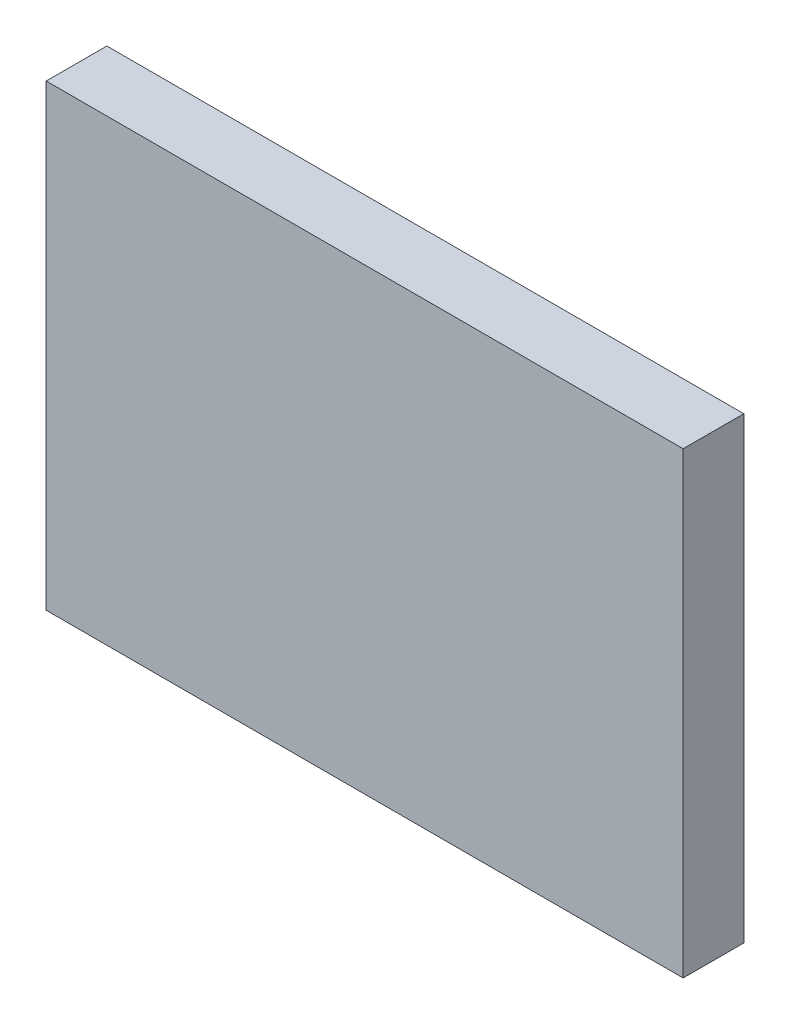
from build123d import *

# Parameters (mm, degrees)
SKETCH1_W           = 66.7
SKETCH1_H           = 48
BOSS_EXTRUDE1_DEPTH = 6.35


with BuildPart() as part:
    # Sketch1 → Boss-Extrude1 (new body)
    with BuildSketch(Plane.XY):
        with Locations((33.35, 24)):
            Rectangle(SKETCH1_W, SKETCH1_H)
    extrude(amount=BOSS_EXTRUDE1_DEPTH)


solid = part.part
